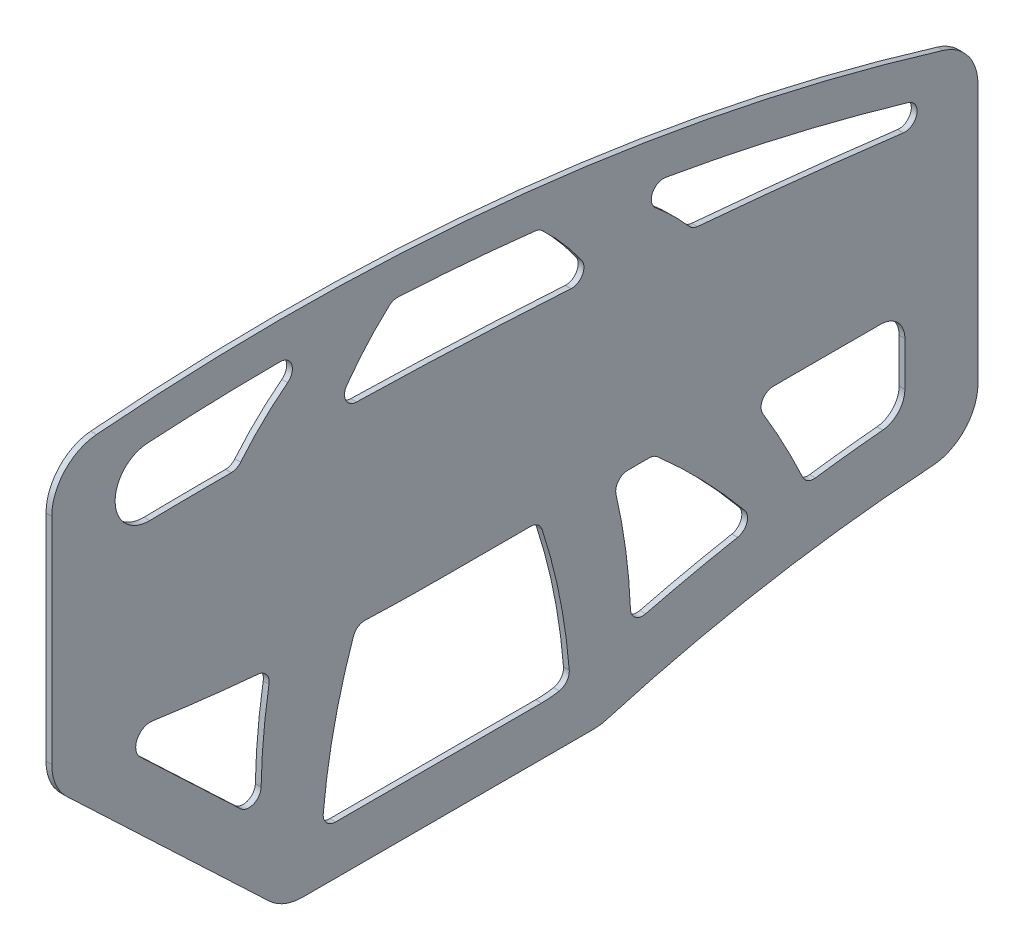
from build123d import *

# Parameters (mm, degrees)
BOSS_EXTRUDE1_DEPTH = 3


with BuildPart() as part:
    # Sketch3 → Boss-Extrude1 (new body)
    with BuildSketch(Plane(origin=(0, 0, 0), x_dir=(0, 0, -1), z_dir=(1, 0, 0))):
        with BuildLine():
            Line((296.275579055, -106.762485274), (296.275579055, 28.183515817))
            ThreePointArc((296.275579055, 28.183515817), (291.290828585, 43.295682658), (278.29309192, 52.476323454))
            ThreePointArc((278.29309192, 52.476323454), (59.883707169, 97.109052306), (-163.023302782, 99.793218303))
            ThreePointArc((-163.023302782, 99.793218303), (-179.612272596, 91.682532966), (-186.324420945, 74.480085446))
            Line((-186.324420945, 74.480085446), (-186.324420945, -37.496742321))
            ThreePointArc((-186.324420945, -37.496742321), (-184.257501936, -47.533043008), (-178.393135002, -55.935940492))
            Line((-178.393135002, -55.935940492), (-73.021933987, -155.761288823))
            ThreePointArc((-73.021933987, -155.761288823), (-64.95546345, -160.91780672), (-55.55321993, -162.722090651))
            Line((-55.55321993, -162.722090651), (95.783603989, -162.722090651))
            ThreePointArc((95.783603989, -162.722090651), (99.360261791, -162.469009329), (102.86564516, -161.714808681))
            ThreePointArc((102.86564516, -161.714808681), (186.857264311, -142.254171864), (272.475288326, -132.112059831))
            ThreePointArc((272.475288326, -132.112059831), (289.393038593, -124.148217707), (296.275579055, -106.762485274))
        make_face()
        with BuildLine():
            Line((-140.201640509, -57.128850103), (-87.96769136, -106.613644033))
            ThreePointArc((-87.96769136, -106.613644033), (-81.148094961, -107.861160131), (-77.251705961, -102.126934444))
            ThreePointArc((-77.251705961, -102.126934444), (-76.008202248, -79.905919655), (-73.146568748, -57.834878595))
            ThreePointArc((-73.146568748, -57.834878595), (-74.384458899, -52.907294986), (-78.839479519, -50.464705473))
            ThreePointArc((-78.839479519, -50.464705473), (-106.402906269, -47.617091315), (-133.882969985, -44.053736318))
            ThreePointArc((-133.882969985, -44.053736318), (-141.821884271, -48.281517128), (-140.201640509, -57.128850103))
        make_face(mode=Mode.SUBTRACT)
        with BuildLine():
            Line((63.109549173, -54.772090651), (16.875579055, -54.772090651))
            ThreePointArc((16.875579055, -54.772090651), (-3.030152717, -54.586152411), (-22.928937744, -54.02840258))
            ThreePointArc((-22.928937744, -54.02840258), (-26.745457872, -55.128882574), (-29.161505638, -58.281594946))
            ThreePointArc((-29.161505638, -58.281594946), (-39.202655269, -93.85476168), (-44.863942819, -130.381802358))
            ThreePointArc((-44.863942819, -130.381802358), (-43.235628118, -135.248430754), (-38.54143859, -137.322090651))
            Line((-38.54143859, -137.322090651), (68.867981086, -137.322090651))
            ThreePointArc((68.867981086, -137.322090651), (73.52045107, -137.108595997), (78.133815642, -136.469906519))
            ThreePointArc((78.133815642, -136.469906519), (82.01587994, -134.088804485), (83.305445186, -129.72107148))
            ThreePointArc((83.305445186, -129.72107148), (78.315586037, -94.014248859), (69.14438597, -59.146427513))
            ThreePointArc((69.14438597, -59.146427513), (66.836279581, -55.980691964), (63.109549173, -54.772090651))
        make_face(mode=Mode.SUBTRACT)
        with BuildLine():
            Line((124.985022972, -54.772090651), (113.865129032, -54.772090651))
            ThreePointArc((113.865129032, -54.772090651), (108.895908777, -57.16869337), (107.677632388, -62.54946071))
            ThreePointArc((107.677632388, -62.54946071), (112.731044206, -90.235858533), (115.209207632, -118.270342681))
            ThreePointArc((115.209207632, -118.270342681), (117.754129966, -123.091695748), (123.099684529, -124.162733326))
            ThreePointArc((123.099684529, -124.162733326), (146.984385828, -118.546914937), (171.026989965, -113.651043346))
            ThreePointArc((171.026989965, -113.651043346), (175.823137855, -109.575179128), (174.754311259, -103.372493144))
            ThreePointArc((174.754311259, -103.372493144), (152.912685544, -78.94134113), (129.173611289, -56.349436473))
            ThreePointArc((129.173611289, -56.349436473), (127.222895395, -55.179496351), (124.985022972, -54.772090651))
        make_face(mode=Mode.SUBTRACT)
        with BuildLine():
            Line((245.475579055, -54.772090651), (189.600512971, -54.772090651))
            ThreePointArc((189.600512971, -54.772090651), (184.070618685, -58.000749725), (184.164076639, -64.403501933))
            ThreePointArc((184.164076639, -64.403501933), (195.077427987, -83.649499652), (204.927221509, -103.460891158))
            ThreePointArc((204.927221509, -103.460891158), (207.64086464, -106.360834644), (211.546531528, -107.081457582))
            ThreePointArc((211.546531528, -107.081457582), (229.074894441, -104.882673663), (246.646711113, -103.063493647))
            ThreePointArc((246.646711113, -103.063493647), (254.86076358, -98.973792541), (258.175579055, -90.417606976))
            Line((258.175579055, -90.417606976), (258.175579055, -67.472090651))
            ThreePointArc((258.175579055, -67.472090651), (254.455835176, -58.49183453), (245.475579055, -54.772090651))
        make_face(mode=Mode.SUBTRACT)
        with BuildLine():
            ThreePointArc((-63.423694749, 73.386671701), (-61.283949627, 80.468910348), (-67.303330529, 84.770499241))
            ThreePointArc((-67.303330529, 84.770499241), (-101.974198169, 84.203420455), (-136.612578489, 82.599285182))
            ThreePointArc((-136.612578489, 82.599285182), (-153.291167029, 64.166222989), (-135.240146412, 47.0748874))
            ThreePointArc((-135.240146412, 47.0748874), (-114.033668366, 47.33348842), (-92.825838328, 47.431113877))
            ThreePointArc((-92.825838328, 47.431113877), (-90.125310843, 48.036382475), (-87.938719053, 49.732853847))
            ThreePointArc((-87.938719053, 49.732853847), (-76.344200811, 62.246895478), (-63.423694749, 73.386671701))
        make_face(mode=Mode.SUBTRACT)
        with BuildLine():
            ThreePointArc((69.231514749, 75.634749617), (67.555654459, 76.763975447), (65.609872244, 77.309493785))
            ThreePointArc((65.609872244, 77.309493785), (29.88891223, 80.823452233), (-5.923738689, 83.229470179))
            ThreePointArc((-5.923738689, 83.229470179), (-8.378239234, 82.871089318), (-10.508168123, 81.599707119))
            ThreePointArc((-10.508168123, 81.599707119), (-22.236344306, 69.777534825), (-32.604624722, 56.746317095))
            ThreePointArc((-32.604624722, 56.746317095), (-33.101585539, 50.220258497), (-27.57017357, 46.721702724))
            ThreePointArc((-27.57017357, 46.721702724), (28.340185633, 44.900589153), (84.202879174, 41.960488643))
            ThreePointArc((84.202879174, 41.960488643), (90.139619886, 45.193850997), (89.79812833, 51.945362376))
            ThreePointArc((89.79812833, 51.945362376), (80.12600177, 64.320669452), (69.231514749, 75.634749617))
        make_face(mode=Mode.SUBTRACT)
        with BuildLine():
            ThreePointArc((145.858420697, 39.213689288), (147.772723887, 37.715638334), (150.109622506, 37.04659558))
            ThreePointArc((150.109622506, 37.04659558), (203.802057157, 31.881595955), (257.384776304, 25.681033985))
            ThreePointArc((257.384776304, 25.681033985), (264.392806933, 30.68986561), (259.959983781, 38.075728216))
            ThreePointArc((259.959983781, 38.075728216), (197.151625063, 54.570624598), (133.51792631, 67.521451383))
            ThreePointArc((133.51792631, 67.521451383), (126.665438798, 63.936972071), (128.357377735, 56.390951951))
            ThreePointArc((128.357377735, 56.390951951), (137.453954347, 48.154898666), (145.858420697, 39.213689288))
        make_face(mode=Mode.SUBTRACT)
    extrude(amount=BOSS_EXTRUDE1_DEPTH)


solid = part.part
